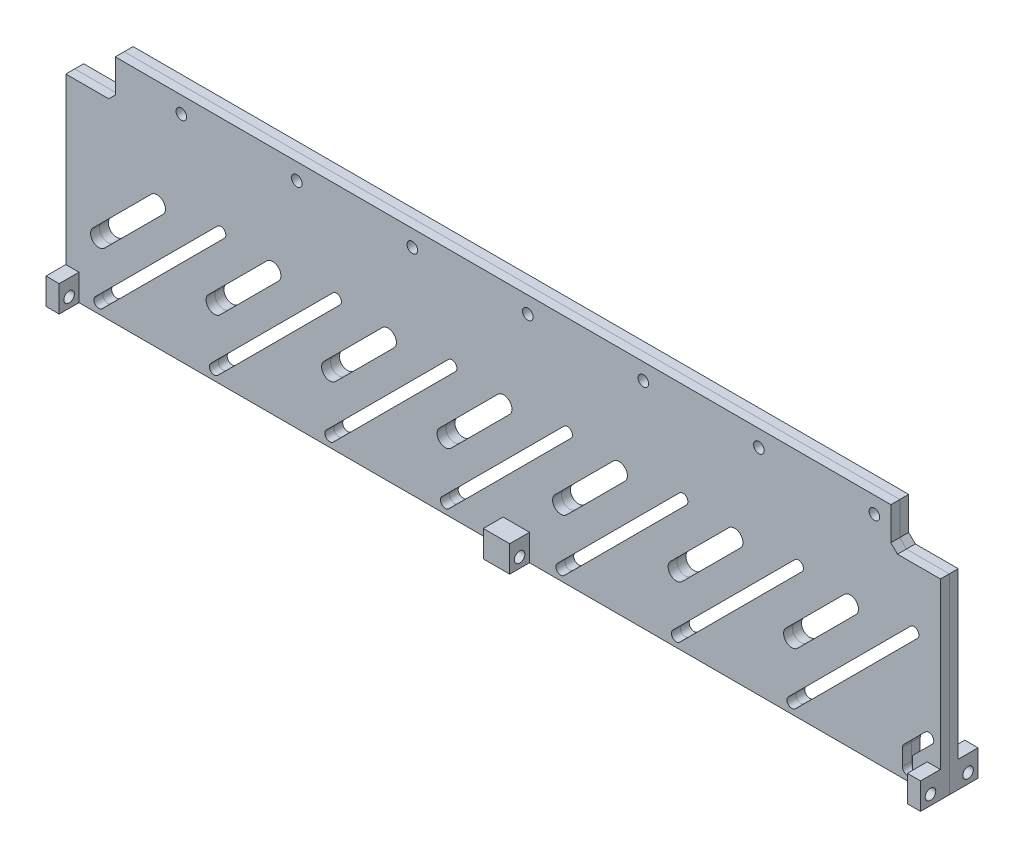
from build123d import *

# Parameters (mm, degrees)
SKETCH_1_W               = 265
SKETCH_1_H               = 70
EXTRUDE_1_DEPTH          = 2.7
CUT_EXTRUDE_5_DEPTH      = 10
SKETCH_2_R               = 1.6
CUT_EXTRUDE_1_DEPTH      = 138.071295317
PATTERN_LINEAR_1_COUNT   = 7
PATTERN_LINEAR_1_PITCH   = 35
CUT_EXTRUDE_4_DEPTH      = 138.071295317
SKETCH_5_W               = 4
SKETCH_5_H               = 8
SKETCH_5_W_2             = 8
EXTRUDE_3_DEPTH          = 6
CUT_EXTRUDE_3_DEPTH      = 264.479961287
CUT_EXTRUDE_3_DEPTH_BACK = 264.479961287
SKETCH_7_R               = 1.6


with BuildPart() as part:
    # 草图1 → 凸台-拉伸1 (new body)
    with BuildSketch(Plane.XY):
        Rectangle(SKETCH_1_W, SKETCH_1_H)
    extrude(amount=EXTRUDE_1_DEPTH)

    # 草图11 → 切除-拉伸5 (cut)
    with BuildSketch(Plane.XY.offset(2.7)):
        Polygon((-132.5, 35), (-132.5, 23), (-119.5, 23), (-117.5, 25), (-117.5, 35), align=None)
        Polygon((117.5, 35), (132.5, 35), (132.5, 23), (119.5, 23), (117.5, 25), align=None)
    extrude(amount=-CUT_EXTRUDE_5_DEPTH, mode=Mode.SUBTRACT)

    # 草图2 → 切除-拉伸1 (cut, through all)
    with BuildSketch(Plane.XY.offset(2.7)):
        with Locations((-97.5, 30)):
            Circle(SKETCH_2_R)
        with BuildLine():
            Line((-123.560660172, -30.939339828), (-86.560660172, 6.060660172))
            ThreePointArc((-86.560660172, 6.060660172), (-84.439339828, 6.060660172), (-84.439339828, 3.939339828))
            Line((-84.439339828, 3.939339828), (-121.439339828, -33.060660172))
            ThreePointArc((-121.439339828, -33.060660172), (-123.560660172, -33.060660172), (-123.560660172, -30.939339828))
        make_face()
        with BuildLine():
            Line((-103.054563517, 0.880465325), (-120.732233047, -16.797204204))
            ThreePointArc((-120.732233047, -16.797204204), (-124.267766953, -16.797204204), (-124.267766953, -13.261670299))
            Line((-124.267766953, -13.261670299), (-106.590097423, 4.415999231))
            ThreePointArc((-106.590097423, 4.415999231), (-103.054563517, 4.415999231), (-103.054563517, 0.880465325))
        make_face()
    cut_extrude_1 = extrude(amount=-CUT_EXTRUDE_1_DEPTH, mode=Mode.SUBTRACT)

    # 阵列(线性)1: 切除-拉伸1 ×7
    with Locations(*[(i * PATTERN_LINEAR_1_PITCH, 0, 0) for i in range(1, PATTERN_LINEAR_1_COUNT)]):
        add(cut_extrude_1, mode=Mode.SUBTRACT)

    # 草图10 → 切除-拉伸4 (cut, through all)
    with BuildSketch(Plane.XY.offset(2.7)):
        with BuildLine():
            Line((121, -32), (121, -27))
            ThreePointArc((121, -27), (121.114180701, -26.425974851), (121.439339828, -25.939339828))
            Line((121.439339828, -25.939339828), (127.939339828, -19.439339828))
            ThreePointArc((127.939339828, -19.439339828), (130.060660172, -19.439339828), (130.060660172, -21.560660172))
            Line((130.060660172, -21.560660172), (124, -27.621320344))
            Line((124, -27.621320344), (124, -32))
            ThreePointArc((124, -32), (122.5, -33.5), (121, -32))
        make_face()
    extrude(amount=-CUT_EXTRUDE_4_DEPTH, mode=Mode.SUBTRACT)

    # 草图5 → 凸台-拉伸3 (add)
    with BuildSketch(Plane.XY.offset(2.7)):
        with Locations((-130.5, -31)):
            Rectangle(SKETCH_5_W, SKETCH_5_H)
        with Locations((130.5, -31)):
            Rectangle(SKETCH_5_W, SKETCH_5_H)
        with Locations((4, -31)):
            Rectangle(SKETCH_5_W_2, SKETCH_5_H)
    extrude(amount=EXTRUDE_3_DEPTH)

    # 草图7 → 切除-拉伸3 (cut, two sides: drawn at the far end of the back side and taken through both)
    with BuildSketch(Plane(origin=(-128.5, 0, 0), x_dir=(0, 0, -1), z_dir=(1, 0, 0)).offset(-CUT_EXTRUDE_3_DEPTH_BACK)):
        with Locations(Location((-5.7, -32, 0), (0, 0, 270))):
            Circle(SKETCH_7_R)
    extrude(amount=CUT_EXTRUDE_3_DEPTH + CUT_EXTRUDE_3_DEPTH_BACK, mode=Mode.SUBTRACT)


with BuildPart() as body_2:
    # 镜向1: mirrored copy
    add(part.part.mirror(Plane.XY))


solid = Compound([part.part, body_2.part])
